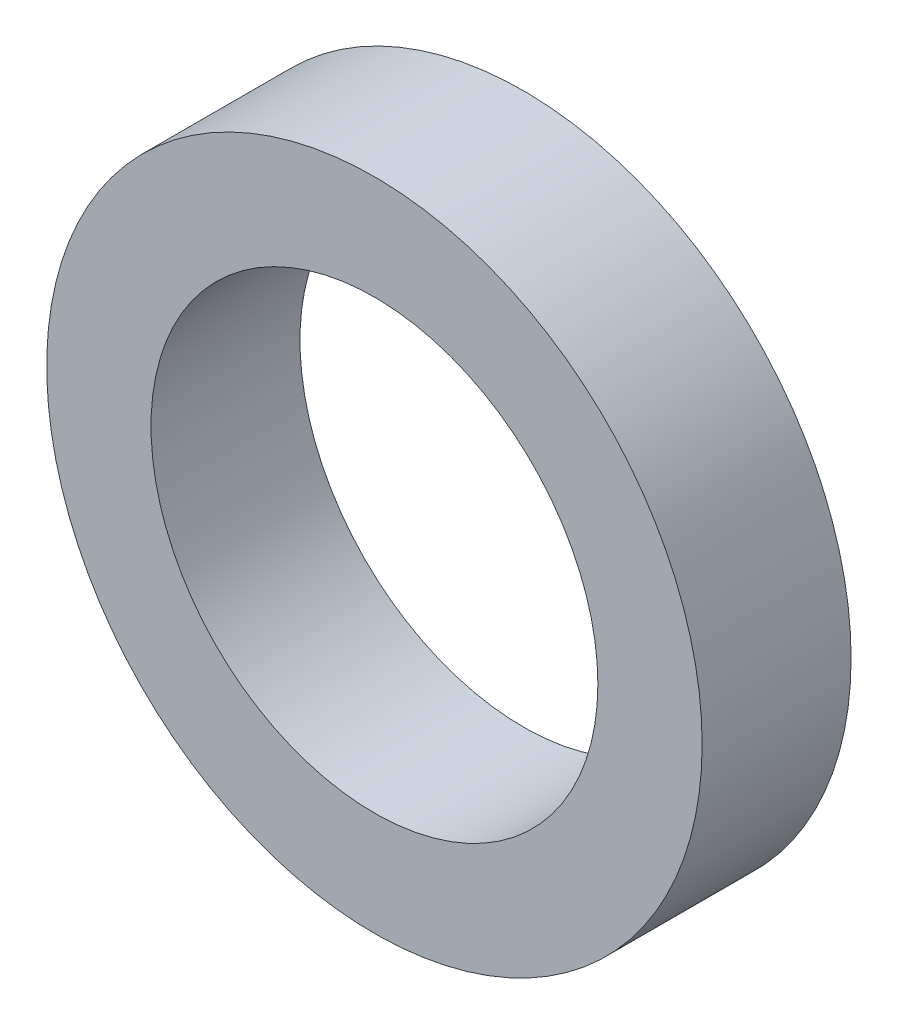
from build123d import *

# Parameters (mm, degrees)
SKETCH1_R           = 22
SKETCH1_R_2         = 15
BOSS_EXTRUDE1_DEPTH = 10


with BuildPart() as part:
    # Sketch1 → Boss-Extrude1 (new body)
    with BuildSketch(Plane.XY):
        Circle(SKETCH1_R)
        Circle(SKETCH1_R_2, mode=Mode.SUBTRACT)
    extrude(amount=BOSS_EXTRUDE1_DEPTH)


solid = part.part
